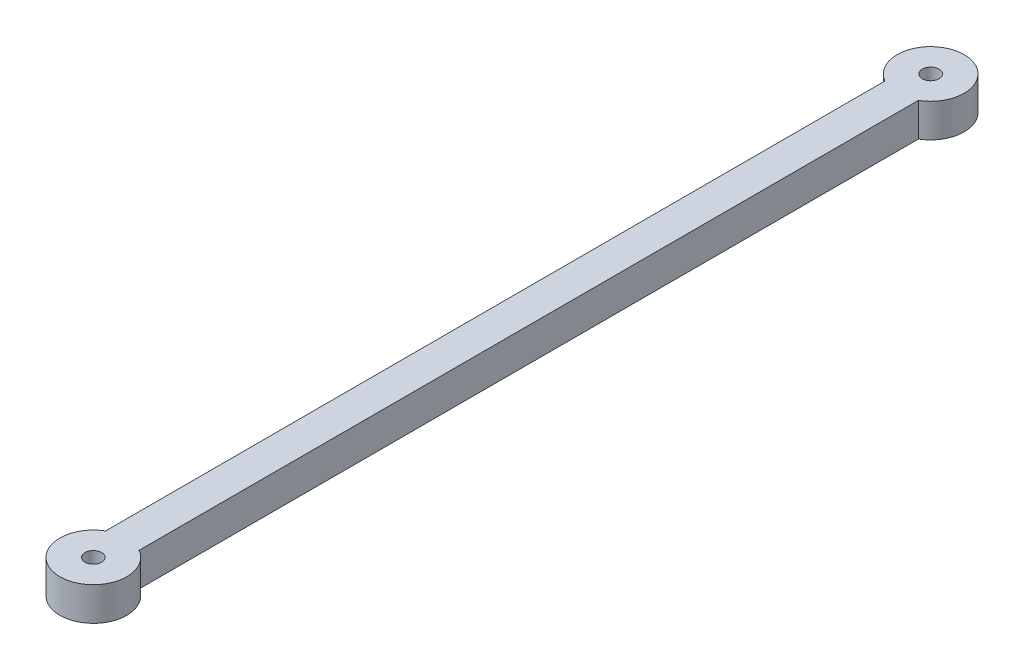
from build123d import *

# Parameters (mm, degrees)
BOSS_EXTRUDE1_DEPTH = 6


with BuildPart() as part:
    # Sketch2 → Boss-Extrude1 (new body)
    with BuildSketch(Plane(origin=(0, 0, 0), x_dir=(1, 0, 0), z_dir=(0, 1, 0))):
        with BuildLine():
            ThreePointArc((1.5, 0), (0, -1.5), (-1.5, 0))
            Line((-1.5, 0), (-3, 0))
            Line((-3, 0), (-3, 5.196152423))
            ThreePointArc((-3, 5.196152423), (-3, -5.196152423), (6, 0))
            ThreePointArc((6, 0), (5.196152423, 3), (3, 5.196152423))
            Line((3, 5.196152423), (3, 0))
            Line((3, 0), (1.5, 0))
        make_face()
        with BuildLine():
            Line((0, 6), (0, 1.5))
            ThreePointArc((0, 1.5), (1.060660172, 1.060660172), (1.5, 0))
            Line((1.5, 0), (3, 0))
            Line((3, 0), (3, 5.196152423))
            ThreePointArc((3, 5.196152423), (1.552914271, 5.795554958), (0, 6))
        make_face()
        with BuildLine():
            ThreePointArc((-1.5, 0), (-1.060660172, 1.060660172), (0, 1.5))
            Line((0, 1.5), (0, 6))
            ThreePointArc((0, 6), (-1.552914271, 5.795554958), (-3, 5.196152423))
            Line((-3, 5.196152423), (-3, 0))
            Line((-3, 0), (-1.5, 0))
        make_face()
        with BuildLine():
            Line((0, 144), (0, 6))
            ThreePointArc((0, 6), (1.552914271, 5.795554958), (3, 5.196152423))
            Line((3, 5.196152423), (3, 144.803847577))
            ThreePointArc((3, 144.803847577), (1.552914271, 144.204445042), (0, 144))
        make_face()
        with BuildLine():
            ThreePointArc((-3, 5.196152423), (-1.552914271, 5.795554958), (0, 6))
            Line((0, 6), (0, 144))
            ThreePointArc((0, 144), (-1.552914271, 144.204445042), (-3, 144.803847577))
            Line((-3, 144.803847577), (-3, 5.196152423))
        make_face()
        with BuildLine():
            Line((0, 148.5), (0, 144))
            ThreePointArc((0, 144), (1.552914271, 144.204445042), (3, 144.803847577))
            Line((3, 144.803847577), (3, 150))
            Line((3, 150), (1.5, 150))
            ThreePointArc((1.5, 150), (1.060660172, 148.939339828), (0, 148.5))
        make_face()
        with BuildLine():
            ThreePointArc((-3, 144.803847577), (-1.552914271, 144.204445042), (0, 144))
            Line((0, 144), (0, 148.5))
            ThreePointArc((0, 148.5), (-1.060660172, 148.939339828), (-1.5, 150))
            Line((-1.5, 150), (-3, 150))
            Line((-3, 150), (-3, 144.803847577))
        make_face()
        with BuildLine():
            ThreePointArc((6, 150), (-3, 155.196152423), (-3, 144.803847577))
            Line((-3, 144.803847577), (-3, 150))
            Line((-3, 150), (-1.5, 150))
            ThreePointArc((-1.5, 150), (0, 151.5), (1.5, 150))
            Line((1.5, 150), (3, 150))
            Line((3, 150), (3, 144.803847577))
            ThreePointArc((3, 144.803847577), (5.196152423, 147), (6, 150))
        make_face()
    extrude(amount=BOSS_EXTRUDE1_DEPTH)


solid = part.part
